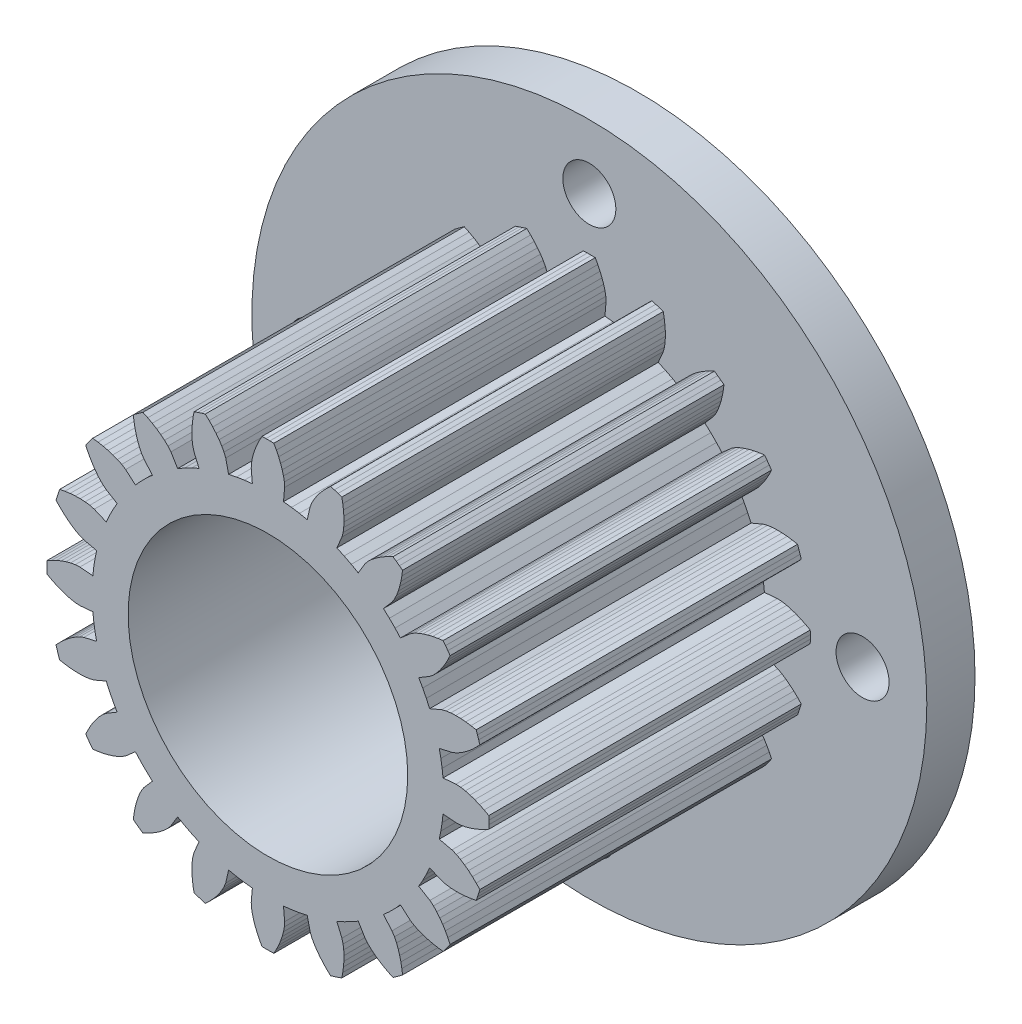
from build123d import *

# Parameters (mm, degrees)
SUN_TEETH_START     = 35
SKETCH_1_R          = 8.7
SUN_TEETH_DEPTH     = 20
SUN_FLANGE_START    = 32
SKETCH_2_R          = 21
SKETCH_2_R_2        = 8.7
SUN_FLANGE_DEPTH    = 3
SKETCH_3_R          = 1.65
THROUGH_HOLES_DEPTH = 100


with BuildPart() as part:
    # Эскиз1 → Sun_teeth (new body)
    with BuildSketch(Plane.XY.offset(SUN_TEETH_START)):
        Polygon((10.894555819, -0.96827669), (11.700038526, -1.039865669), (11.988881941, -1.022674633), (12.28054111, -0.968652849), (12.573555527, -0.889043103), (12.867132278, -0.787536841), (13.160626441, -0.666125627), (13.453455206, -0.52607247), (13.745067754, -0.368255952), (13.749451944, -0.122765032), (13.749451944, 0.122765032), (13.745067754, 0.368255952), (13.453455206, 0.52607247), (13.160626441, 0.666125627), (12.867132278, 0.787536841), (12.573555527, 0.889043103), (12.28054111, 0.968652849), (11.988881941, 1.022674633), (11.700038526, 1.039865669), (10.894555819, 0.96827669), (10.839058231, 1.464145798), (10.761002895, 1.956967794), (10.660552257, 2.445717039), (11.448734045, 2.626539719), (11.718128135, 2.73214689), (11.978818839, 2.873652299), (12.232891344, 3.039912101), (12.480732267, 3.227170498), (12.722343675, 3.433334109), (12.957561574, 3.657021641), (13.186133601, 3.897227302), (13.114442348, 4.13205783), (13.038569385, 4.365570798), (12.958538907, 4.597691747), (12.632430907, 4.657670942), (12.310655397, 4.700380345), (11.994007732, 4.725154587), (11.683432489, 4.730972573), (11.380158454, 4.716139508), (11.086080452, 4.677389637), (10.806061717, 4.60448176), (10.062124352, 4.28748875), (9.856111027, 4.741938599), (9.629585619, 5.186519744), (9.383019562, 5.620306944), (10.076747707, 6.035841099), (10.300322301, 6.219526839), (10.504526318, 6.434664338), (10.694786525, 6.671299529), (10.872631223, 6.925979904), (11.038709267, 7.196715181), (11.193291534, 7.482140994), (11.336448819, 7.781222794), (11.195699761, 7.982406082), (11.05138081, 8.181044077), (10.903537984, 8.377073441), (10.574856256, 8.333344131), (10.255631628, 8.274529086), (9.946826141, 8.200241281), (9.649653676, 8.109801486), (9.365806599, 8.001977572), (9.098096167, 7.874249154), (8.854312298, 7.718379095), (8.244742046, 7.187011538), (7.908379004, 7.55555741), (7.55555741, 7.908379004), (7.187011538, 8.244742046), (7.718379095, 8.854312298), (7.874249154, 9.098096167), (8.001977572, 9.365806599), (8.109801486, 9.649653676), (8.200241281, 9.946826141), (8.274529086, 10.255631628), (8.333344131, 10.574856256), (8.377073441, 10.903537984), (8.181044077, 11.05138081), (7.982406082, 11.195699761), (7.781222794, 11.336448819), (7.482140994, 11.193291534), (7.196715181, 11.038709267), (6.925979904, 10.872631223), (6.671299529, 10.694786525), (6.434664338, 10.504526318), (6.219526839, 10.300322301), (6.035841099, 10.076747707), (5.620306944, 9.383019562), (5.186519744, 9.629585619), (4.741938599, 9.856111027), (4.28748875, 10.062124352), (4.60448176, 10.806061717), (4.677389637, 11.086080452), (4.716139508, 11.380158454), (4.730972573, 11.683432489), (4.725154587, 11.994007732), (4.700380345, 12.310655397), (4.657670942, 12.632430907), (4.597691747, 12.958538907), (4.365570798, 13.038569385), (4.13205783, 13.114442348), (3.897227302, 13.186133601), (3.657021641, 12.957561574), (3.433334109, 12.722343675), (3.227170498, 12.480732267), (3.039912101, 12.232891344), (2.873652299, 11.978818839), (2.73214689, 11.718128135), (2.626539719, 11.448734045), (2.445717039, 10.660552257), (1.956967794, 10.761002895), (1.464145798, 10.839058231), (0.96827669, 10.894555819), (1.039865669, 11.700038526), (1.022674633, 11.988881941), (0.968652849, 12.28054111), (0.889043103, 12.573555527), (0.787536841, 12.867132278), (0.666125627, 13.160626441), (0.52607247, 13.453455206), (0.368255952, 13.745067754), (0.122765032, 13.749451944), (-0.122765032, 13.749451944), (-0.368255952, 13.745067754), (-0.52607247, 13.453455206), (-0.666125627, 13.160626441), (-0.787536841, 12.867132278), (-0.889043103, 12.573555527), (-0.968652849, 12.28054111), (-1.022674633, 11.988881941), (-1.039865669, 11.700038526), (-0.96827669, 10.894555819), (-1.464145798, 10.839058231), (-1.956967794, 10.761002895), (-2.445717039, 10.660552257), (-2.626539719, 11.448734045), (-2.73214689, 11.718128135), (-2.873652299, 11.978818839), (-3.039912101, 12.232891344), (-3.227170498, 12.480732267), (-3.433334109, 12.722343675), (-3.657021641, 12.957561574), (-3.897227302, 13.186133601), (-4.13205783, 13.114442348), (-4.365570798, 13.038569385), (-4.597691747, 12.958538907), (-4.657670942, 12.632430907), (-4.700380345, 12.310655397), (-4.725154587, 11.994007732), (-4.730972573, 11.683432489), (-4.716139508, 11.380158454), (-4.677389637, 11.086080452), (-4.60448176, 10.806061717), (-4.28748875, 10.062124352), (-4.741938599, 9.856111027), (-5.186519744, 9.629585619), (-5.620306944, 9.383019562), (-6.035841099, 10.076747707), (-6.219526839, 10.300322301), (-6.434664338, 10.504526318), (-6.671299529, 10.694786525), (-6.925979904, 10.872631223), (-7.196715181, 11.038709267), (-7.482140994, 11.193291534), (-7.781222794, 11.336448819), (-7.982406082, 11.195699761), (-8.181044077, 11.05138081), (-8.377073441, 10.903537984), (-8.333344131, 10.574856256), (-8.274529086, 10.255631628), (-8.200241281, 9.946826141), (-8.109801486, 9.649653676), (-8.001977572, 9.365806599), (-7.874249154, 9.098096167), (-7.718379095, 8.854312298), (-7.187011538, 8.244742046), (-7.55555741, 7.908379004), (-7.908379004, 7.55555741), (-8.244742046, 7.187011538), (-8.854312298, 7.718379095), (-9.098096167, 7.874249154), (-9.365806599, 8.001977572), (-9.649653676, 8.109801486), (-9.946826141, 8.200241281), (-10.255631628, 8.274529086), (-10.574856256, 8.333344131), (-10.903537984, 8.377073441), (-11.05138081, 8.181044077), (-11.195699761, 7.982406082), (-11.336448819, 7.781222794), (-11.193291534, 7.482140994), (-11.038709267, 7.196715181), (-10.872631223, 6.925979904), (-10.694786525, 6.671299529), (-10.504526318, 6.434664338), (-10.300322301, 6.219526839), (-10.076747707, 6.035841099), (-9.383019562, 5.620306944), (-9.629585619, 5.186519744), (-9.856111027, 4.741938599), (-10.062124352, 4.28748875), (-10.806061717, 4.60448176), (-11.086080452, 4.677389637), (-11.380158454, 4.716139508), (-11.683432489, 4.730972573), (-11.994007732, 4.725154587), (-12.310655397, 4.700380345), (-12.632430907, 4.657670942), (-12.958538907, 4.597691747), (-13.038569385, 4.365570798), (-13.114442348, 4.13205783), (-13.186133601, 3.897227302), (-12.957561574, 3.657021641), (-12.722343675, 3.433334109), (-12.480732267, 3.227170498), (-12.232891344, 3.039912101), (-11.978818839, 2.873652299), (-11.718128135, 2.73214689), (-11.448734045, 2.626539719), (-10.660552257, 2.445717039), (-10.761002895, 1.956967794), (-10.839058231, 1.464145798), (-10.894555819, 0.96827669), (-11.700038526, 1.039865669), (-11.988881941, 1.022674633), (-12.28054111, 0.968652849), (-12.573555527, 0.889043103), (-12.867132278, 0.787536841), (-13.160626441, 0.666125627), (-13.453455206, 0.52607247), (-13.745067754, 0.368255952), (-13.749451944, 0.122765032), (-13.749451944, -0.122765032), (-13.745067754, -0.368255952), (-13.453455206, -0.52607247), (-13.160626441, -0.666125627), (-12.867132278, -0.787536841), (-12.573555527, -0.889043103), (-12.28054111, -0.968652849), (-11.988881941, -1.022674633), (-11.700038526, -1.039865669), (-10.894555819, -0.96827669), (-10.839058231, -1.464145798), (-10.761002895, -1.956967794), (-10.660552257, -2.445717039), (-11.448734045, -2.626539719), (-11.718128135, -2.73214689), (-11.978818839, -2.873652299), (-12.232891344, -3.039912101), (-12.480732267, -3.227170498), (-12.722343675, -3.433334109), (-12.957561574, -3.657021641), (-13.186133601, -3.897227302), (-13.114442348, -4.13205783), (-13.038569385, -4.365570798), (-12.958538907, -4.597691747), (-12.632430907, -4.657670942), (-12.310655397, -4.700380345), (-11.994007732, -4.725154587), (-11.683432489, -4.730972573), (-11.380158454, -4.716139508), (-11.086080452, -4.677389637), (-10.806061717, -4.60448176), (-10.062124352, -4.28748875), (-9.856111027, -4.741938599), (-9.629585619, -5.186519744), (-9.383019562, -5.620306944), (-10.076747707, -6.035841099), (-10.300322301, -6.219526839), (-10.504526318, -6.434664338), (-10.694786525, -6.671299529), (-10.872631223, -6.925979904), (-11.038709267, -7.196715181), (-11.193291534, -7.482140994), (-11.336448819, -7.781222794), (-11.195699761, -7.982406082), (-11.05138081, -8.181044077), (-10.903537984, -8.377073441), (-10.574856256, -8.333344131), (-10.255631628, -8.274529086), (-9.946826141, -8.200241281), (-9.649653676, -8.109801486), (-9.365806599, -8.001977572), (-9.098096167, -7.874249154), (-8.854312298, -7.718379095), (-8.244742046, -7.187011538), (-7.908379004, -7.55555741), (-7.55555741, -7.908379004), (-7.187011538, -8.244742046), (-7.718379095, -8.854312298), (-7.874249154, -9.098096167), (-8.001977572, -9.365806599), (-8.109801486, -9.649653676), (-8.200241281, -9.946826141), (-8.274529086, -10.255631628), (-8.333344131, -10.574856256), (-8.377073441, -10.903537984), (-8.181044077, -11.05138081), (-7.982406082, -11.195699761), (-7.781222794, -11.336448819), (-7.482140994, -11.193291534), (-7.196715181, -11.038709267), (-6.925979904, -10.872631223), (-6.671299529, -10.694786525), (-6.434664338, -10.504526318), (-6.219526839, -10.300322301), (-6.035841099, -10.076747707), (-5.620306944, -9.383019562), (-5.186519744, -9.629585619), (-4.741938599, -9.856111027), (-4.28748875, -10.062124352), (-4.60448176, -10.806061717), (-4.677389637, -11.086080452), (-4.716139508, -11.380158454), (-4.730972573, -11.683432489), (-4.725154587, -11.994007732), (-4.700380345, -12.310655397), (-4.657670942, -12.632430907), (-4.597691747, -12.958538907), (-4.365570798, -13.038569385), (-4.13205783, -13.114442348), (-3.897227302, -13.186133601), (-3.657021641, -12.957561574), (-3.433334109, -12.722343675), (-3.227170498, -12.480732267), (-3.039912101, -12.232891344), (-2.873652299, -11.978818839), (-2.73214689, -11.718128135), (-2.626539719, -11.448734045), (-2.445717039, -10.660552257), (-1.956967794, -10.761002895), (-1.464145798, -10.839058231), (-0.96827669, -10.894555819), (-1.039865669, -11.700038526), (-1.022674633, -11.988881941), (-0.968652849, -12.28054111), (-0.889043103, -12.573555527), (-0.787536841, -12.867132278), (-0.666125627, -13.160626441), (-0.52607247, -13.453455206), (-0.368255952, -13.745067754), (-0.122765032, -13.749451944), (0.122765032, -13.749451944), (0.368255952, -13.745067754), (0.52607247, -13.453455206), (0.666125627, -13.160626441), (0.787536841, -12.867132278), (0.889043103, -12.573555527), (0.968652849, -12.28054111), (1.022674633, -11.988881941), (1.039865669, -11.700038526), (0.96827669, -10.894555819), (1.464145798, -10.839058231), (1.956967794, -10.761002895), (2.445717039, -10.660552257), (2.626539719, -11.448734045), (2.73214689, -11.718128135), (2.873652299, -11.978818839), (3.039912101, -12.232891344), (3.227170498, -12.480732267), (3.433334109, -12.722343675), (3.657021641, -12.957561574), (3.897227302, -13.186133601), (4.13205783, -13.114442348), (4.365570798, -13.038569385), (4.597691747, -12.958538907), (4.657670942, -12.632430907), (4.700380345, -12.310655397), (4.725154587, -11.994007732), (4.730972573, -11.683432489), (4.716139508, -11.380158454), (4.677389637, -11.086080452), (4.60448176, -10.806061717), (4.28748875, -10.062124352), (4.741938599, -9.856111027), (5.186519744, -9.629585619), (5.620306944, -9.383019562), (6.035841099, -10.076747707), (6.219526839, -10.300322301), (6.434664338, -10.504526318), (6.671299529, -10.694786525), (6.925979904, -10.872631223), (7.196715181, -11.038709267), (7.482140994, -11.193291534), (7.781222794, -11.336448819), (7.982406082, -11.195699761), (8.181044077, -11.05138081), (8.377073441, -10.903537984), (8.333344131, -10.574856256), (8.274529086, -10.255631628), (8.200241281, -9.946826141), (8.109801486, -9.649653676), (8.001977572, -9.365806599), (7.874249154, -9.098096167), (7.718379095, -8.854312298), (7.187011538, -8.244742046), (7.55555741, -7.908379004), (7.908379004, -7.55555741), (8.244742046, -7.187011538), (8.854312298, -7.718379095), (9.098096167, -7.874249154), (9.365806599, -8.001977572), (9.649653676, -8.109801486), (9.946826141, -8.200241281), (10.255631628, -8.274529086), (10.574856256, -8.333344131), (10.903537984, -8.377073441), (11.05138081, -8.181044077), (11.195699761, -7.982406082), (11.336448819, -7.781222794), (11.193291534, -7.482140994), (11.038709267, -7.196715181), (10.872631223, -6.925979904), (10.694786525, -6.671299529), (10.504526318, -6.434664338), (10.300322301, -6.219526839), (10.076747707, -6.035841099), (9.383019562, -5.620306944), (9.629585619, -5.186519744), (9.856111027, -4.741938599), (10.062124352, -4.28748875), (10.806061717, -4.60448176), (11.086080452, -4.677389637), (11.380158454, -4.716139508), (11.683432489, -4.730972573), (11.994007732, -4.725154587), (12.310655397, -4.700380345), (12.632430907, -4.657670942), (12.958538907, -4.597691747), (13.038569385, -4.365570798), (13.114442348, -4.13205783), (13.186133601, -3.897227302), (12.957561574, -3.657021641), (12.722343675, -3.433334109), (12.480732267, -3.227170498), (12.232891344, -3.039912101), (11.978818839, -2.873652299), (11.718128135, -2.73214689), (11.448734045, -2.626539719), (10.660552257, -2.445717039), (10.761002895, -1.956967794), (10.839058231, -1.464145798), align=None)
        Circle(SKETCH_1_R, mode=Mode.SUBTRACT)
    extrude(amount=SUN_TEETH_DEPTH)

    # Эскиз2 → Sun_flange (add)
    with BuildSketch(Plane.XY.offset(SUN_FLANGE_START)):
        Circle(SKETCH_2_R)
        Circle(SKETCH_2_R_2, mode=Mode.SUBTRACT)
    extrude(amount=SUN_FLANGE_DEPTH)

    # Эскиз3 → Through_holes (cut, symmetric)
    with BuildSketch(Plane.XY):
        with Locations((17, 0)):
            Circle(SKETCH_3_R)
        with Locations((0, 17)):
            Circle(SKETCH_3_R)
        with Locations((-17, 0)):
            Circle(SKETCH_3_R)
        with Locations((0, -17)):
            Circle(SKETCH_3_R)
    extrude(amount=THROUGH_HOLES_DEPTH, both=True, mode=Mode.SUBTRACT)


solid = part.part
